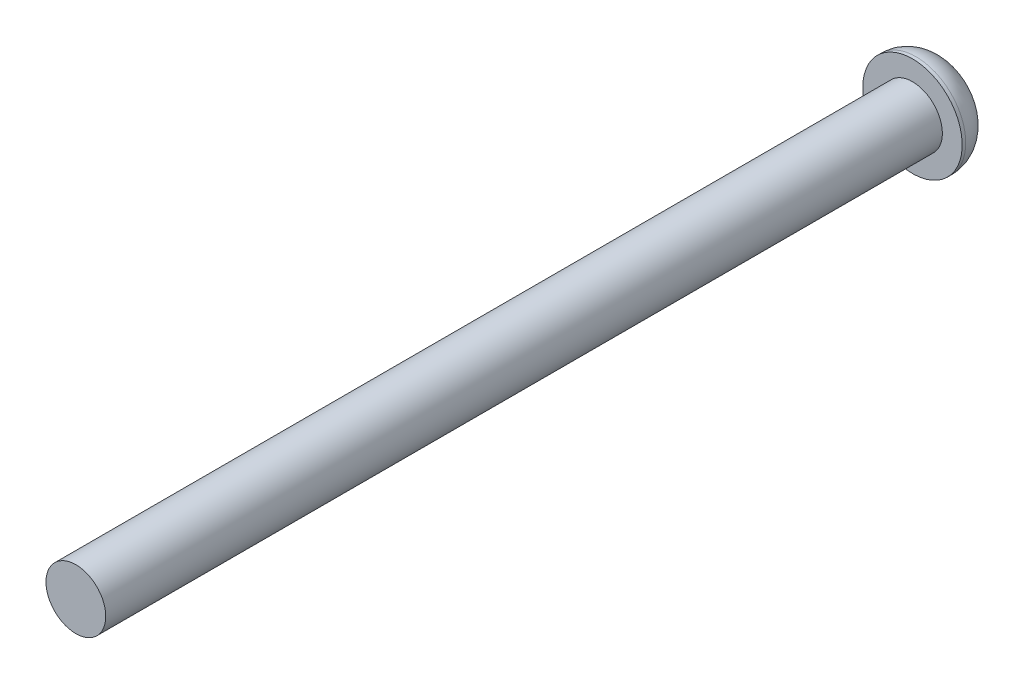
from build123d import *

# Parameters (mm, degrees)
SKETCH1_R           = 2.5
BOSS_EXTRUDE1_DEPTH = 70
SKETCH2_R           = 4.159584877
BOSS_EXTRUDE2_DEPTH = 2.8
FILLET1_R           = 2.5
CUT_EXTRUDE1_DEPTH  = 2


with BuildPart() as part:
    # Sketch1 → Boss-Extrude1 (new body)
    with BuildSketch(Plane.XY):
        Circle(SKETCH1_R)
    extrude(amount=BOSS_EXTRUDE1_DEPTH)

    # Sketch2 → Boss-Extrude2 (add)
    with BuildSketch(Plane(origin=(0, 0, 0), x_dir=(-1, 0, 0), z_dir=(0, 0, -1))):
        Circle(SKETCH2_R)
    extrude(amount=BOSS_EXTRUDE2_DEPTH)

    # Fillet1
    fillet1_edges = [part.edges().sort_by_distance(p)[0] for p in [
        (4.159584877, 0, -2.8),
    ]]
    fillet(fillet1_edges, radius=FILLET1_R)

    # Sketch3 → Cut-Extrude1 (cut)
    with BuildSketch(Plane(origin=(0, 0, -2.8), x_dir=(-1, 0, 0), z_dir=(0, 0, -1))):
        Polygon((1.392434699, -0.636521364), (1.247461021, 0.88762314), (-0.144973678, 1.524144504), (-1.392434699, 0.636521364), (-1.247461021, -0.88762314), (0.144973678, -1.524144504), align=None)
    extrude(amount=-CUT_EXTRUDE1_DEPTH, mode=Mode.SUBTRACT)


solid = part.part
